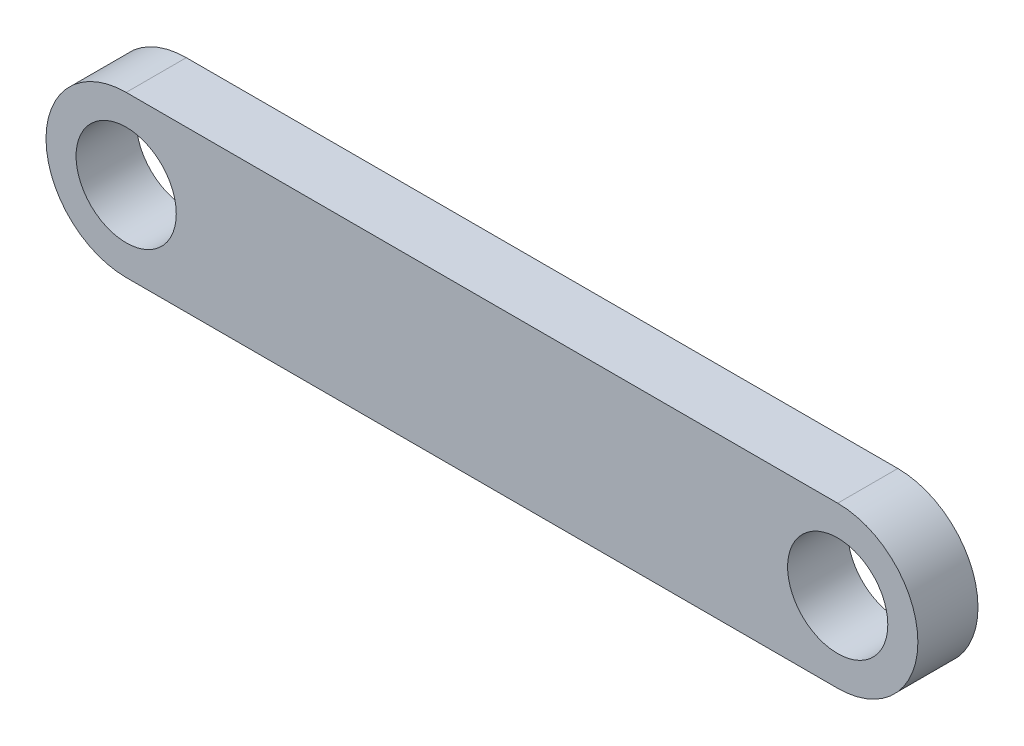
from build123d import *

# Parameters (mm, degrees)
SKETCH2_R           = 2.5
BOSS_EXTRUDE1_DEPTH = 3


with BuildPart() as part:
    # Sketch2 → Boss-Extrude1 (new body)
    with BuildSketch(Plane.XY):
        with BuildLine():
            Line((-35.5, 4), (0, 4))
            ThreePointArc((0, 4), (4, 0), (0, -4))
            Line((0, -4), (-35.5, -4))
            ThreePointArc((-35.5, -4), (-39.5, 0), (-35.5, 4))
        make_face()
        with Locations((-35.5, 0)):
            Circle(SKETCH2_R, mode=Mode.SUBTRACT)
        Circle(SKETCH2_R, mode=Mode.SUBTRACT)
    extrude(amount=BOSS_EXTRUDE1_DEPTH)


solid = part.part
